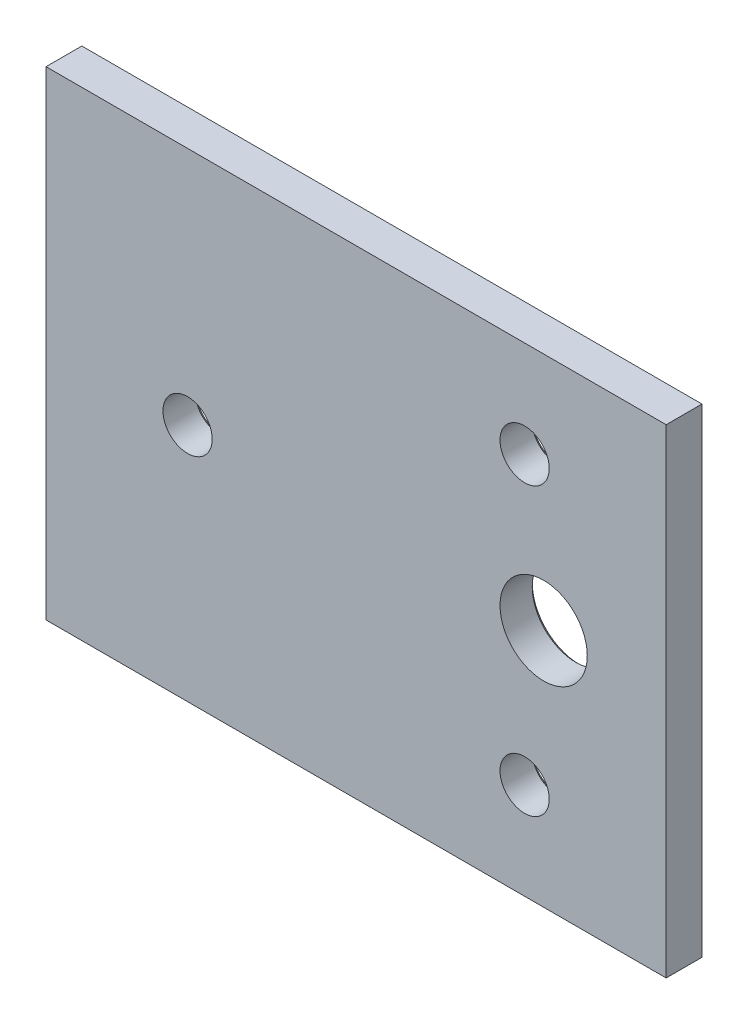
from build123d import *

# Parameters (mm, degrees)
ESQUISSE2_W                        = 110
ESQUISSE2_H                        = 85
BOSS_EXTRU_1_DEPTH                 = 3.175
F_5_16_CLEARANCE_HOLE1_D           = 8.72998
F_5_16_CLEARANCE_HOLE1_CSINK_D     = 9.99998
F_5_16_CLEARANCE_HOLE1_CSINK_ANGLE = 90


with BuildPart() as part:
    # Esquisse2 → Boss.-Extru.1 (new, symmetric)
    with BuildSketch(Plane.XY):
        Rectangle(ESQUISSE2_W, ESQUISSE2_H)
    extrude(amount=BOSS_EXTRU_1_DEPTH, both=True)

    # 5/16 Clearance Hole1 (through all)
    with Locations(Plane(origin=(0, 0, -3.175), x_dir=(-1, 0, 0), z_dir=(0, 0, -1))):
        with Locations((-29.89199, 25.4), (-29.89199, -25.4), (29.89199, 0)):
            CounterSinkHole(F_5_16_CLEARANCE_HOLE1_D / 2, F_5_16_CLEARANCE_HOLE1_CSINK_D / 2, counter_sink_angle=F_5_16_CLEARANCE_HOLE1_CSINK_ANGLE)

    # Sketch4 → 9/16 Clearance Hole1 (revolve, cut)
    with BuildSketch(Plane(origin=(33.26638, 0, -3.175), x_dir=(0, 1, 0), z_dir=(1, 0, 0))):
        Polygon((0, 0), (0, 6.35), (7.73938, 6.35), (7.73938, 0.635), (8.37438, 0), align=None)
    revolve(axis=Axis((33.26638, 0, -9.525), (0, 0, 1)), mode=Mode.SUBTRACT)


solid = part.part
